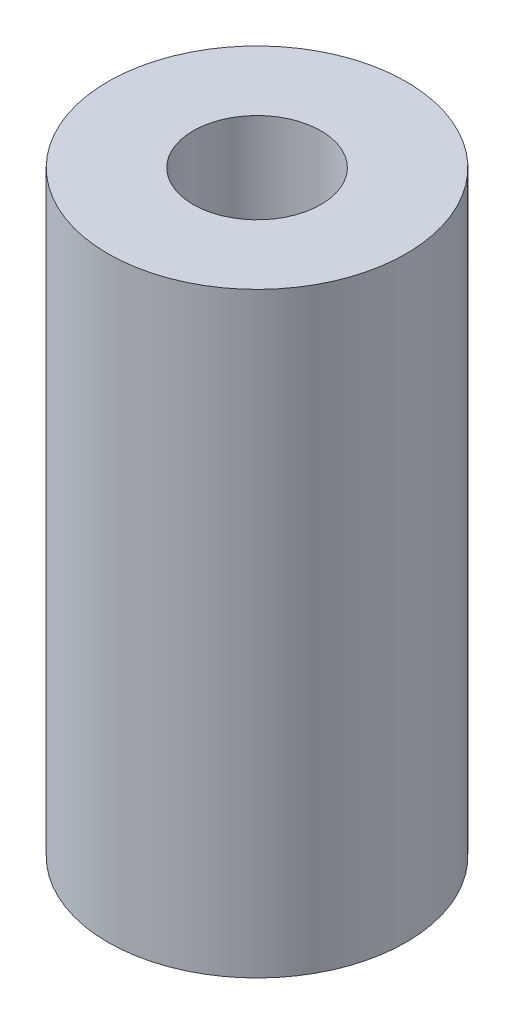
from build123d import *

# Parameters (mm, degrees)
SKETCH1_R           = 3.5
SKETCH1_R_2         = 1.5
BOSS_EXTRUDE1_DEPTH = 14


with BuildPart() as part:
    # Sketch1 → Boss-Extrude1 (new body)
    with BuildSketch(Plane(origin=(0, 0, 0), x_dir=(1, 0, 0), z_dir=(0, 1, 0))):
        with Locations(Location((0, 0, 0), (0, 0, 270))):
            Circle(SKETCH1_R)
        with Locations(Location((0, 0, 0), (0, 0, 270))):
            Circle(SKETCH1_R_2, mode=Mode.SUBTRACT)
    extrude(amount=BOSS_EXTRUDE1_DEPTH)


solid = part.part
